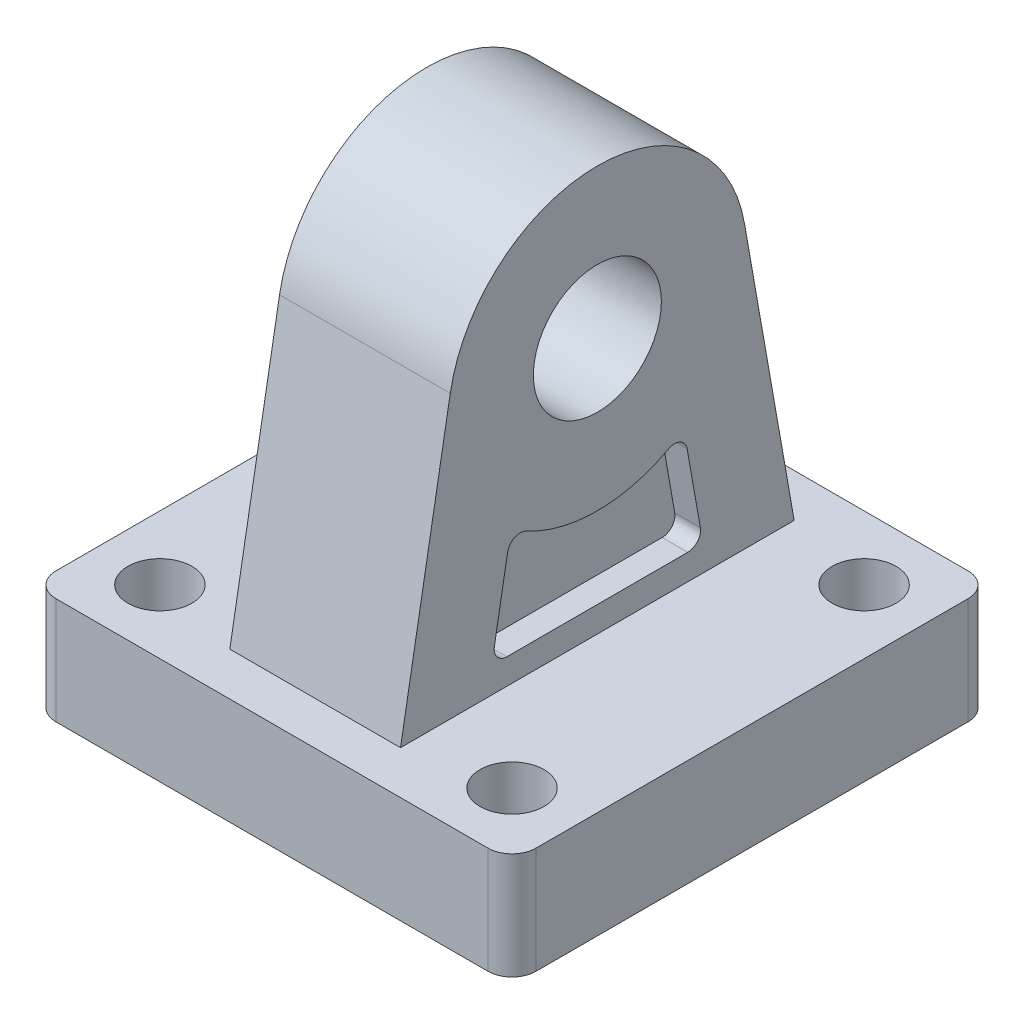
from build123d import *

# Parameters (mm, degrees)
SKETCH_3_W               = 45
SKETCH_3_H               = 45
EXTRUDE_1_DEPTH          = 10
EXTRUDE_START            = -8
EXTRUDE_2_DEPTH          = 16
SKETCH_5_R               = 6
CUT_EXTRUDE_1_DEPTH      = 62.159627206
CUT_EXTRUDE_START        = -2.4
CUT_EXTRUDE_3_DEPTH      = 2.4
SKETCH_7_R               = 3
CUT_EXTRUDE_2_DEPTH      = 50.563091106
MIRROR_2_COPY_1_SKETCH_R = 3
MIRROR_2_COPY_1_DEPTH    = 50.563091106
FILLET_1_R               = 2.25
FILLET_2_R               = 1.2


with BuildPart() as part:
    # 草图3 → 凸台-拉伸1 (new body)
    with BuildSketch(Plane(origin=(0, 0, 0), x_dir=(1, 0, 0), z_dir=(0, 1, 0))):
        Rectangle(SKETCH_3_W, SKETCH_3_H)
    extrude(amount=EXTRUDE_1_DEPTH)

    # 草图4 → 凸台-拉伸2 (add)
    with BuildSketch(Plane(origin=(0, 0, 0), x_dir=(0, 0, -1), z_dir=(1, 0, 0)).offset(EXTRUDE_START)):
        with BuildLine():
            Line((-13.787308542, 36.431074487), (-18.447820103, 10))
            Line((-18.447820103, 10), (18.447820103, 10))
            Line((18.447820103, 10), (13.787308542, 36.431074487))
            ThreePointArc((13.787308542, 36.431074487), (0, 48), (-13.787308542, 36.431074487))
        make_face()
    extrude(amount=EXTRUDE_2_DEPTH)

    # 草图5 → 切除-拉伸1 (cut, through all)
    with BuildSketch(Plane(origin=(8, 0, 0), x_dir=(0, 0, -1), z_dir=(1, 0, 0))):
        with Locations((0, 34)):
            Circle(SKETCH_5_R)
    extrude(amount=-CUT_EXTRUDE_1_DEPTH, mode=Mode.SUBTRACT)

    # 草图8 → 切除-拉伸3 (cut)
    with BuildSketch(Plane(origin=(8, 0, 0), x_dir=(0, 0, -1), z_dir=(1, 0, 0)).offset(CUT_EXTRUDE_START)):
        with BuildLine():
            Line((-8.10534153, 22.584946838), (-9.901222455, 12.4))
            Line((-9.901222455, 12.4), (9.901222455, 12.4))
            Line((9.901222455, 12.4), (8.10534153, 22.584946838))
            ThreePointArc((8.10534153, 22.584946838), (0, 20), (-8.10534153, 22.584946838))
        make_face()
    cut_extrude_3 = extrude(amount=CUT_EXTRUDE_3_DEPTH, mode=Mode.SUBTRACT)

    # 镜向3: 切除-拉伸3 across plane
    add(cut_extrude_3.mirror(Plane(origin=(0, 0, 0), x_dir=(0, 0, 1), z_dir=(1, 0, 0))), mode=Mode.SUBTRACT)

    # 草图7 → 切除-拉伸2 (cut, through all)
    with BuildSketch(Plane(origin=(0, 10, 0), x_dir=(1, 0, 0), z_dir=(0, 1, 0))):
        with Locations(Location((-16.5, 16.5, 0), (0, 0, 270))):
            Circle(SKETCH_7_R)
    cut_extrude_2 = extrude(amount=-CUT_EXTRUDE_2_DEPTH, mode=Mode.SUBTRACT)

    # 镜向1: 切除-拉伸2 across plane
    add(cut_extrude_2.mirror(Plane(origin=(0, 0, 0), x_dir=(0, 0, 1), z_dir=(1, 0, 0))), mode=Mode.SUBTRACT)

    # 镜向2: 切除-拉伸2 across plane
    add(cut_extrude_2.mirror(Plane.XY), mode=Mode.SUBTRACT)

    # 镜向2 copy 1 sketch → 镜向2 copy 1 (cut, through all)
    with BuildSketch(Plane(origin=(0, 10, 0), x_dir=(-1, 0, 0), z_dir=(0, 1, 0))):
        with Locations(Location((-16.5, 16.5, 0), (0, 0, 270))):
            Circle(MIRROR_2_COPY_1_SKETCH_R)
    extrude(amount=-MIRROR_2_COPY_1_DEPTH, mode=Mode.SUBTRACT)

    # 圆角1
    fillet_1_edges = [part.edges().sort_by_distance(p)[0] for p in [
        (-22.5, 5, 22.5),
        (-22.5, 5, -22.5),
        (22.5, 5, -22.5),
        (22.5, 5, 22.5),
    ]]
    fillet(fillet_1_edges, radius=FILLET_1_R)

    # 圆角2
    fillet_2_edges = [part.edges().sort_by_distance(p)[0] for p in [
        (6.8, 22.584946838, 8.10534153),
        (6.8, 22.584946838, -8.10534153),
        (6.8, 12.4, -9.901222455),
        (6.8, 12.4, 9.901222455),
        (-6.8, 22.584946838, -8.10534153),
        (-6.8, 22.584946838, 8.10534153),
        (-6.8, 12.4, 9.901222455),
        (-6.8, 12.4, -9.901222455),
    ]]
    fillet(fillet_2_edges, radius=FILLET_2_R)


solid = part.part
